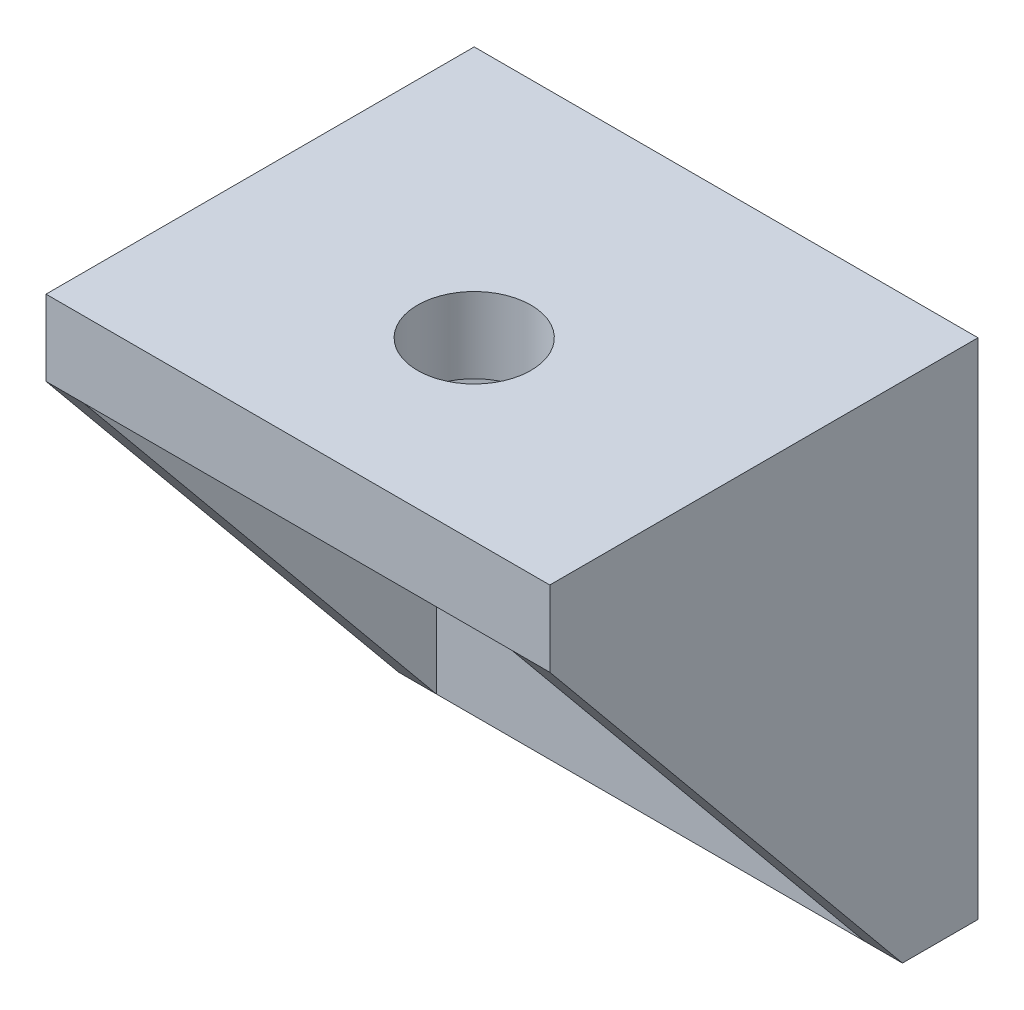
from build123d import *

# Parameters (mm, degrees)
SKETCH_1_W          = 20
SKETCH_1_H          = 20
EXTRUDE_1_DEPTH     = 17
CUT_EXTRUDE_1_DEPTH = 20
SKETCH_3_W          = 17
SKETCH_3_H          = 17
CUT_EXTRUDE_2_DEPTH = 14
HOLE_WIZARD_M4_1_D  = 4.5
SKETCH_9_R          = 2.05
EXTRUDE_3_DEPTH     = 5


with BuildPart() as part:
    # 스케치1 → 보스-돌출1 (new body)
    with BuildSketch(Plane.XY):
        Rectangle(SKETCH_1_W, SKETCH_1_H)
    extrude(amount=EXTRUDE_1_DEPTH)

    # 스케치2 → 컷-돌출1 (cut)
    with BuildSketch(Plane(origin=(10, 0, 0), x_dir=(0, 0, -1), z_dir=(1, 0, 0))):
        Polygon((-17, 7), (-3, -10), (-17, -10), align=None)
    extrude(amount=-CUT_EXTRUDE_1_DEPTH, mode=Mode.SUBTRACT)

    # 스케치3 → 컷-돌출2 (cut)
    with BuildSketch(Plane.XY.offset(17)):
        with Locations((0, -1.5)):
            Rectangle(SKETCH_3_W, SKETCH_3_H)
    extrude(amount=-CUT_EXTRUDE_2_DEPTH, mode=Mode.SUBTRACT)

    # M4 여유 구멍1 (through all)
    with Locations(Plane(origin=(0, 7, 0), x_dir=(-1, 0, 0), z_dir=(0, -1, 0))):
        with Locations((0, -10)):
            Hole(HOLE_WIZARD_M4_1_D / 2)

    # 스케치9 → 보스-돌출3 (add)
    with BuildSketch(Plane(origin=(0, 0, 0), x_dir=(-1, 0, 0), z_dir=(0, 0, -1))):
        with Locations((0, 1.5)):
            Circle(SKETCH_9_R)
    extrude(amount=EXTRUDE_3_DEPTH)


solid = part.part
